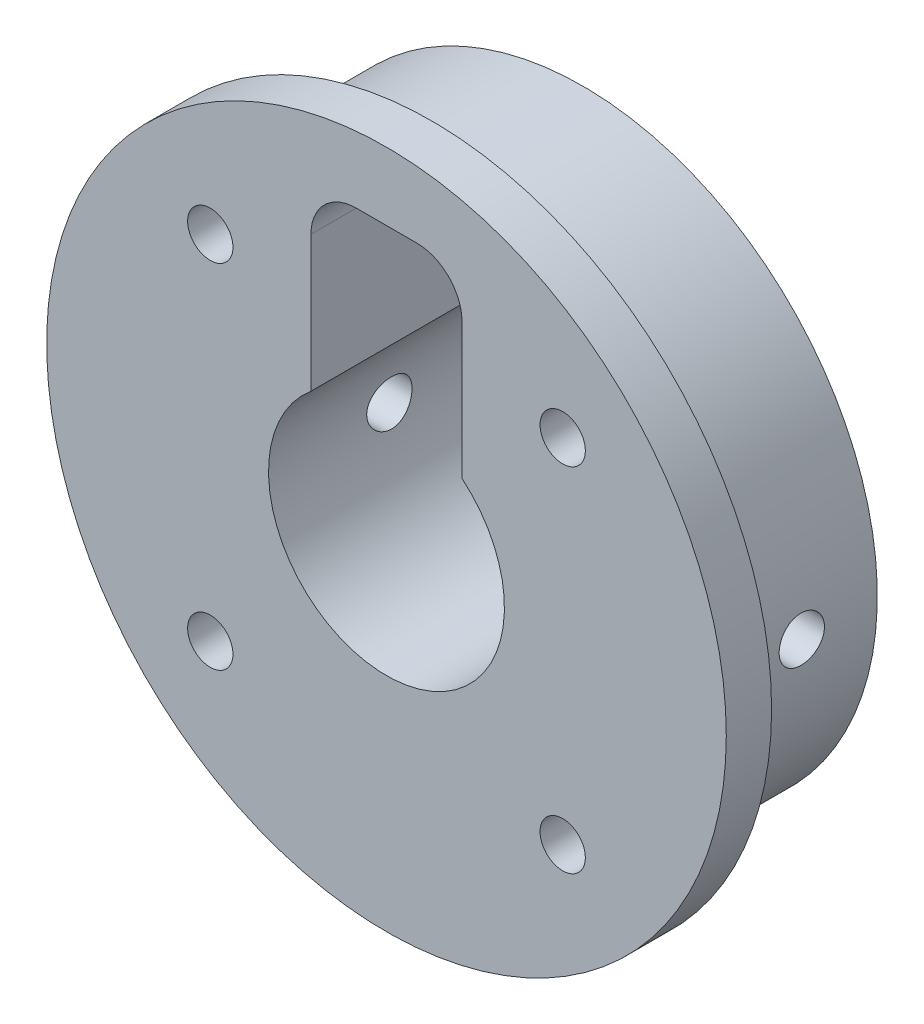
from build123d import *

# Parameters (mm, degrees)
SKETCH1_R               = 22.5
BOSS_EXTRUDE1_DEPTH     = 3
SKETCH2_R               = 19.5
BOSS_EXTRUDE2_DEPTH     = 10
SKETCH3_R               = 1.5
CUT_EXTRUDE1_DEPTH      = 13
CUT_EXTRUDE2_DEPTH      = 60.505474974
CUT_EXTRUDE2_DEPTH_BACK = 60.505474974
SKETCH4_R               = 1.5


with BuildPart() as part:
    # Sketch1 → Boss-Extrude1 (new body)
    with BuildSketch(Plane.XY):
        with Locations((750, 29.313623227)):
            Circle(SKETCH1_R)
    extrude(amount=BOSS_EXTRUDE1_DEPTH)

    # Sketch2 → Boss-Extrude2 (add)
    with BuildSketch(Plane(origin=(0, 0, 0), x_dir=(-1, 0, 0), z_dir=(0, 0, -1))):
        with Locations((-750, 29.313623227)):
            Circle(SKETCH2_R)
    extrude(amount=BOSS_EXTRUDE2_DEPTH)

    # Sketch3 → Cut-Extrude1 (cut)
    with BuildSketch(Plane.XY.offset(3)):
        with Locations((761.66726189, 17.646361337)):
            Circle(SKETCH3_R)
        with Locations((738.33273811, 17.646361337)):
            Circle(SKETCH3_R)
        with Locations((738.33273811, 40.980885116)):
            Circle(SKETCH3_R)
        with Locations((761.66726189, 40.980885116)):
            Circle(SKETCH3_R)
        with BuildLine():
            Line((748, 47.313623227), (752, 47.313623227))
            ThreePointArc((752, 47.313623227), (754.121320344, 46.43494357), (755, 44.313623227))
            Line((755, 44.313623227), (755, 35.313623227))
            ThreePointArc((755, 35.313623227), (750, 21.503373551), (745, 35.313623227))
            Line((745, 35.313623227), (745, 44.313623227))
            ThreePointArc((745, 44.313623227), (745.878679656, 46.43494357), (748, 47.313623227))
        make_face()
    extrude(amount=-CUT_EXTRUDE1_DEPTH, mode=Mode.SUBTRACT)

    # Sketch4 → Cut-Extrude2 (cut, two sides: drawn at the far end of the back side and taken through both)
    with BuildSketch(Plane(origin=(745, 0, 0), x_dir=(0, 0, -1), z_dir=(1, 0, 0)).offset(-CUT_EXTRUDE2_DEPTH_BACK)):
        with Locations((5, 29.313623227)):
            Circle(SKETCH4_R)
    extrude(amount=CUT_EXTRUDE2_DEPTH + CUT_EXTRUDE2_DEPTH_BACK, mode=Mode.SUBTRACT)


solid = part.part
